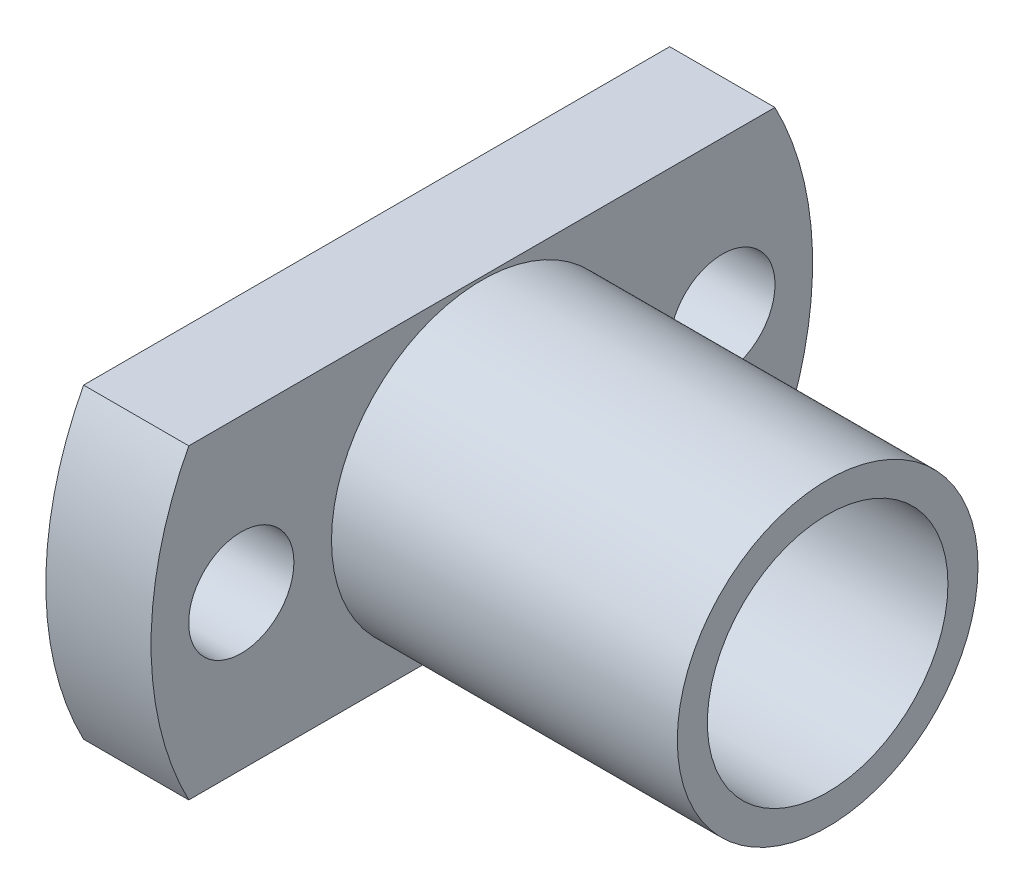
from build123d import *

# Parameters (mm, degrees)
SKETCH_1_R          = 5
SKETCH_1_R_2        = 4
EXTRUDE_1_DEPTH     = 1.5
SKETCH_2_R          = 4
SKETCH_2_R_2        = 1.75
EXTRUDE_2_DEPTH     = 3.5
SKETCH_3_R          = 5
SKETCH_3_R_2        = 4
EXTRUDE_3_DEPTH     = 11.5
SKETCH_4_R          = 5
CUT_EXTRUDE_1_DEPTH = 1.5


with BuildPart() as part:
    # 草图1 → 凸台-拉伸1 (new body)
    with BuildSketch(Plane(origin=(0, 0, 0), x_dir=(0, 0, -1), z_dir=(1, 0, 0))):
        Circle(SKETCH_1_R)
        Circle(SKETCH_1_R_2, mode=Mode.SUBTRACT)
    extrude(amount=EXTRUDE_1_DEPTH)

    # 草图2 → 凸台-拉伸2 (add)
    with BuildSketch(Plane(origin=(1.5, 0, 0), x_dir=(0, 0, -1), z_dir=(1, 0, 0))):
        with BuildLine():
            Line((-9.746281342, 5.1), (9.746281342, 5.1))
            ThreePointArc((9.746281342, 5.1), (11, 0), (9.746281342, -5.1))
            Line((9.746281342, -5.1), (-9.746281342, -5.1))
            ThreePointArc((-9.746281342, -5.1), (-11, 0), (-9.746281342, 5.1))
        make_face()
        Circle(SKETCH_2_R, mode=Mode.SUBTRACT)
        with Locations((-8, 0)):
            Circle(SKETCH_2_R_2, mode=Mode.SUBTRACT)
        with Locations((8, 0)):
            Circle(SKETCH_2_R_2, mode=Mode.SUBTRACT)
    extrude(amount=EXTRUDE_2_DEPTH)

    # 草图3 → 凸台-拉伸3 (add)
    with BuildSketch(Plane(origin=(5, 0, 0), x_dir=(0, 0, -1), z_dir=(1, 0, 0))):
        Circle(SKETCH_3_R)
        Circle(SKETCH_3_R_2, mode=Mode.SUBTRACT)
    extrude(amount=EXTRUDE_3_DEPTH)

    # 草图4 → 切除-拉伸1 (cut)
    with BuildSketch(Plane.ZY):
        with Locations(Location((0, 0, 0), (0, 0, 180))):
            Circle(SKETCH_4_R)
    extrude(amount=-CUT_EXTRUDE_1_DEPTH, mode=Mode.SUBTRACT)


solid = part.part
